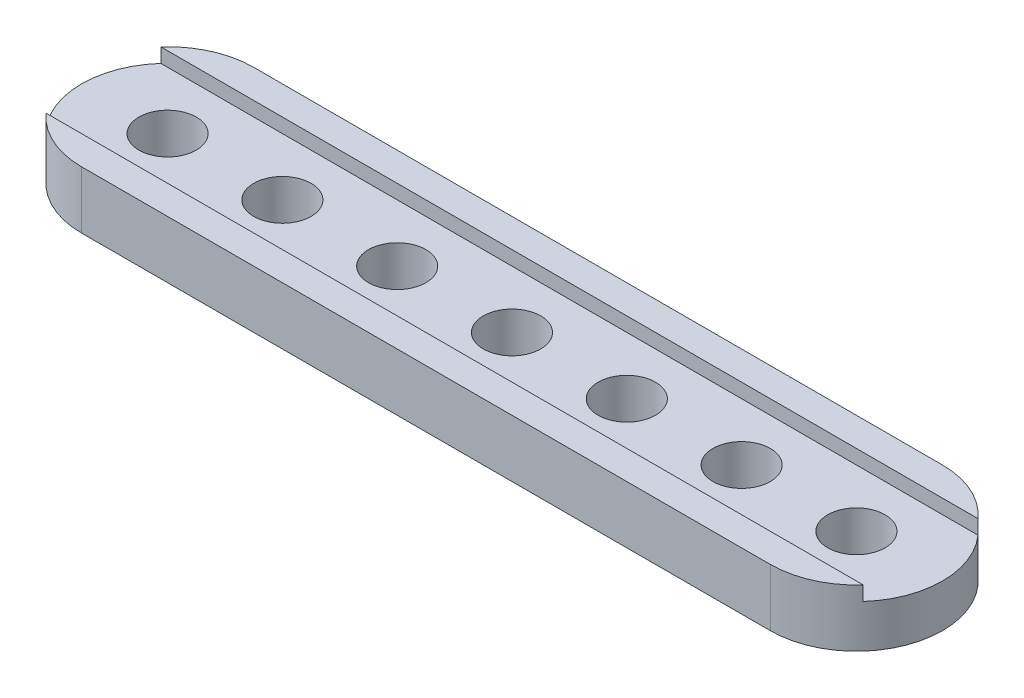
from build123d import *

# Parameters (mm, degrees)
SKETCH1_R           = 2
BOSS_EXTRUDE1_DEPTH = 4
SKETCH2_W           = 8
SKETCH2_H           = 1
CUT_EXTRUDE1_DEPTH  = 32
SKETCH2_2_W         = 8
SKETCH2_2_H         = 1
CUT_EXTRUDE2_DEPTH  = 35


with BuildPart() as part:
    # Sketch1 → Boss-Extrude1 (new body)
    with BuildSketch(Plane(origin=(0, 0, 0), x_dir=(1, 0, 0), z_dir=(0, 1, 0))):
        with BuildLine():
            Line((24, -6), (-24, -6))
            ThreePointArc((-24, -6), (-30, 0), (-24, 6))
            Line((-24, 6), (24, 6))
            ThreePointArc((24, 6), (30, 0), (24, -6))
        make_face()
        with Locations((-24, 0)):
            Circle(SKETCH1_R, mode=Mode.SUBTRACT)
        with Locations((-16, 0)):
            Circle(SKETCH1_R, mode=Mode.SUBTRACT)
        with Locations((-8, 0)):
            Circle(SKETCH1_R, mode=Mode.SUBTRACT)
        Circle(SKETCH1_R, mode=Mode.SUBTRACT)
        with Locations((8, 0)):
            Circle(SKETCH1_R, mode=Mode.SUBTRACT)
        with Locations((16, 0)):
            Circle(SKETCH1_R, mode=Mode.SUBTRACT)
        with Locations((24, 0)):
            Circle(SKETCH1_R, mode=Mode.SUBTRACT)
    extrude(amount=BOSS_EXTRUDE1_DEPTH)

    # Sketch2 → Cut-Extrude1 (cut)
    with BuildSketch(Plane(origin=(0, 0, 0), x_dir=(0, 0, -1), z_dir=(1, 0, 0))):
        with Locations((0, 3.5)):
            Rectangle(SKETCH2_W, SKETCH2_H)
    extrude(amount=-CUT_EXTRUDE1_DEPTH, mode=Mode.SUBTRACT)

    # Sketch2<2> → Cut-Extrude2 (cut)
    with BuildSketch(Plane(origin=(0, 0, 0), x_dir=(0, 0, -1), z_dir=(1, 0, 0))):
        with Locations((0, 3.5)):
            Rectangle(SKETCH2_2_W, SKETCH2_2_H)
    extrude(amount=CUT_EXTRUDE2_DEPTH, mode=Mode.SUBTRACT)


solid = part.part
